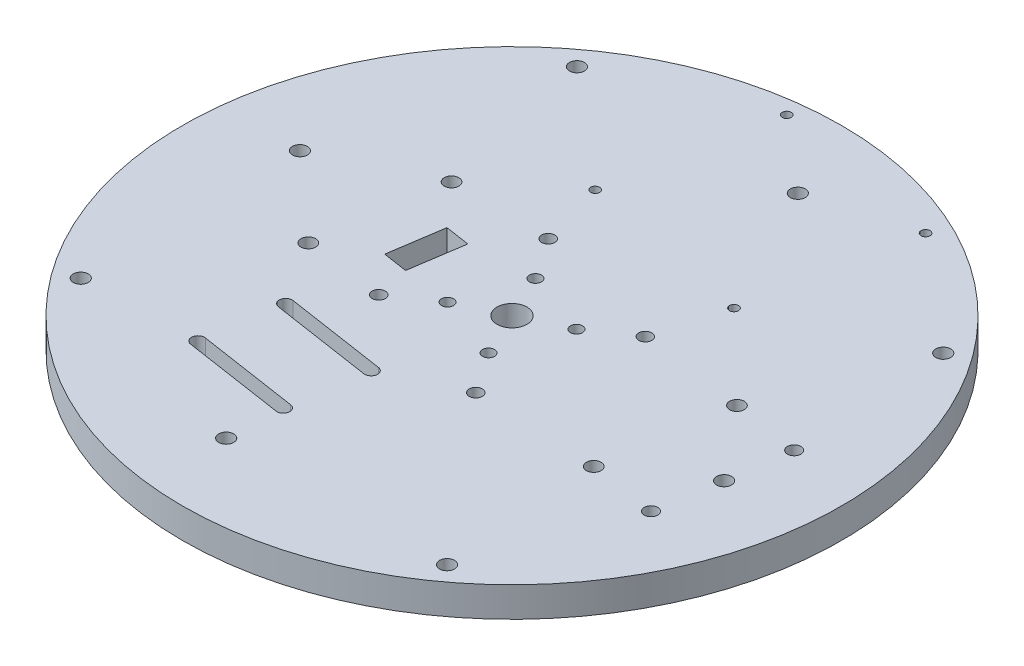
from build123d import *

# Parameters (mm, degrees)
CROQUIS1_R              = 110
SALIENTE_EXTRUIR1_DEPTH = 10
CORTAR_EXTRUIR1_DEPTH   = 10
CROQUIS4_R              = 2
CORTAR_EXTRUIR3_DEPTH   = 156.884572681
CROQUIS5_R              = 2.45
CROQUIS5_R_2            = 2.25
CORTAR_EXTRUIR4_DEPTH   = 7
CROQUIS8_R              = 5
CORTAR_EXTRUIR5_DEPTH   = 156.884572681
CROQUIS11_R             = 2.5
CORTAR_EXTRUIR6_DEPTH   = 10
CROQUIS12_R             = 1.5
CORTAR_EXTRUIR7_DEPTH   = 10
CORTAR_EXTRUIR8_DEPTH   = 156.884572681
CROQUIS14_R             = 2.5
CORTAR_EXTRUIR9_DEPTH   = 5
CROQUIS17_R             = 2.186456698
CORTAR_EXTRUIR10_DEPTH  = 156.884572681


with BuildPart() as part:
    # Croquis1 → Saliente-Extruir1 (new body)
    with BuildSketch(Plane(origin=(0, 0, 0), x_dir=(1, 0, 0), z_dir=(0, 1, 0))):
        with Locations(Location((0, 0, 0), (0, 0, 270))):
            Circle(CROQUIS1_R)
    extrude(amount=SALIENTE_EXTRUIR1_DEPTH)

    # Croquis2 → Cortar-Extruir1 (cut)
    with BuildSketch(Plane(origin=(0, 10, 0), x_dir=(1, 0, 0), z_dir=(0, 1, 0))):
        with BuildLine():
            Line((-40.925729633, -32.159166383), (-7.30856573, -37.247023602))
            ThreePointArc((-7.30856573, -37.247023602), (-5.504506631, -39.694546997), (-7.952030025, -41.498606096))
            Line((-7.952030025, -41.498606096), (-41.569193929, -36.410748877))
            ThreePointArc((-41.569193929, -36.410748877), (-43.373253028, -33.963225482), (-40.925729633, -32.159166383))
        make_face()
        with BuildLine():
            Line((-11.802959176, -66.941742857), (-45.419686894, -61.851004448))
            ThreePointArc((-45.419686894, -61.851004448), (-47.223536218, -59.403326443), (-44.775858213, -57.599477119))
            Line((-44.775858213, -57.599477119), (-11.159130495, -62.690215528))
            ThreePointArc((-11.159130495, -62.690215528), (-9.355281171, -65.137893533), (-11.802959176, -66.941742857))
        make_face()
    extrude(amount=-CORTAR_EXTRUIR1_DEPTH, mode=Mode.SUBTRACT)

    # Croquis4 → Cortar-Extruir3 (cut, through all)
    with BuildSketch(Plane.XZ):
        with Locations(Location((-6.850793921, -14.673517402, 0), (0, 0, 270))):
            Circle(CROQUIS4_R)
        with Locations(Location((14.673517402, -6.850793921, 0), (0, 0, 270))):
            Circle(CROQUIS4_R)
        with Locations(Location((-14.673517402, 6.850793921, 0), (0, 0, 270))):
            Circle(CROQUIS4_R)
        with Locations(Location((6.850793921, 14.673517402, 0), (0, 0, 270))):
            Circle(CROQUIS4_R)
    extrude(amount=-CORTAR_EXTRUIR3_DEPTH, mode=Mode.SUBTRACT)

    # Croquis5 → Cortar-Extruir4 (cut)
    with BuildSketch(Plane(origin=(0, 10, 0), x_dir=(1, 0, 0), z_dir=(0, 1, 0))):
        with Locations(Location((-48.761952302, 28.58020577, 0), (0, 0, 270))):
            Circle(CROQUIS5_R)
        with Locations(Location((-55.046952396, -12.946879052, 0), (0, 0, 270))):
            Circle(CROQUIS5_R)
        with Locations(Location((63.492012818, 11.590903863, 0), (0, 0, 270))):
            Circle(CROQUIS5_R)
        with Locations(Location((57.207012724, -29.936180959, 0), (0, 0, 270))):
            Circle(CROQUIS5_R)
        with Locations(Location((85.994568937, 8.185209293, 0), (0, 0, 270))):
            Circle(CROQUIS5_R_2)
        with Locations(Location((79.709568842, -33.341875529, 0), (0, 0, 270))):
            Circle(CROQUIS5_R_2)
    extrude(amount=-CORTAR_EXTRUIR4_DEPTH, mode=Mode.SUBTRACT)

    # Croquis8 → Cortar-Extruir5 (cut, through all)
    with BuildSketch(Plane(origin=(0, 10, 0), x_dir=(1, 0, 0), z_dir=(0, 1, 0))):
        with Locations(Location((0, 0, 0), (0, 0, 270))):
            Circle(CROQUIS8_R)
    extrude(amount=-CORTAR_EXTRUIR5_DEPTH, mode=Mode.SUBTRACT)

    # Croquis11 → Cortar-Extruir6 (cut)
    with BuildSketch(Plane.XZ):
        with Locations(Location((-83.094178071, -12.302746472, 0), (0, 0, 270))):
            Circle(CROQUIS11_R)
        with Locations(Location((12.302746472, -83.094178071, 0), (0, 0, 270))):
            Circle(CROQUIS11_R)
        with Locations(Location((83.094178071, 12.302746472, 0), (0, 0, 270))):
            Circle(CROQUIS11_R)
        with Locations(Location((-12.302746472, 83.094178071, 0), (0, 0, 270))):
            Circle(CROQUIS11_R)
    extrude(amount=-CORTAR_EXTRUIR6_DEPTH, mode=Mode.SUBTRACT)

    # Croquis12 → Cortar-Extruir7 (cut)
    with BuildSketch(Plane(origin=(0, 10, 0), x_dir=(1, 0, 0), z_dir=(0, 1, 0))):
        with Locations(Location((34.860845045, 39.241411656, 0), (0, 0, 270))):
            Circle(CROQUIS12_R)
        with Locations(Location((45.170870311, 92.869347277, 0), (0, 0, 270))):
            Circle(CROQUIS12_R)
        with Locations(Location((-12.198549191, 103.898676632, 0), (0, 0, 270))):
            Circle(CROQUIS12_R)
        with Locations(Location((-22.508574457, 50.270741011, 0), (0, 0, 270))):
            Circle(CROQUIS12_R)
    extrude(amount=-CORTAR_EXTRUIR7_DEPTH, mode=Mode.SUBTRACT)

    # Croquis13 → Cortar-Extruir8 (cut, through all)
    with BuildSketch(Plane(origin=(0, 10, 0), x_dir=(1, 0, 0), z_dir=(0, 1, 0))):
        Polygon((-39.036973786, -3.44597737), (-30.835647873, -4.687223519), (-28.104551712, 13.358036658), (-36.305877626, 14.599282808), align=None)
    extrude(amount=-CORTAR_EXTRUIR8_DEPTH, mode=Mode.SUBTRACT)

    # Croquis14 → Cortar-Extruir9 (cut)
    with BuildSketch(Plane(origin=(0, 10, 0), x_dir=(1, 0, 0), z_dir=(0, 1, 0))):
        with Locations(Location((-61.128340654, 82.810846507, 0), (0, 0, 270))):
            Circle(CROQUIS14_R)
        with Locations(Location((-82.810846507, -61.128340654, 0), (0, 0, 270))):
            Circle(CROQUIS14_R)
        with Locations(Location((61.128340654, -82.810846507, 0), (0, 0, 270))):
            Circle(CROQUIS14_R)
        with Locations(Location((82.810846507, 61.128340654, 0), (0, 0, 270))):
            Circle(CROQUIS14_R)
    extrude(amount=-CORTAR_EXTRUIR9_DEPTH, mode=Mode.SUBTRACT)

    # Croquis17 → Cortar-Extruir10 (cut, through all)
    with BuildSketch(Plane.XZ):
        with Locations(Location((-28.290947151, 16.202590632, 0), (0, 0, 270))):
            Circle(CROQUIS17_R)
        with Locations(Location((16.202590632, 28.290947151, 0), (0, 0, 270))):
            Circle(CROQUIS17_R)
        with Locations(Location((28.290947151, -16.202590632, 0), (0, 0, 270))):
            Circle(CROQUIS17_R)
        with Locations(Location((-16.202590632, -28.290947151, 0), (0, 0, 270))):
            Circle(CROQUIS17_R)
    extrude(amount=-CORTAR_EXTRUIR10_DEPTH, mode=Mode.SUBTRACT)


solid = part.part
